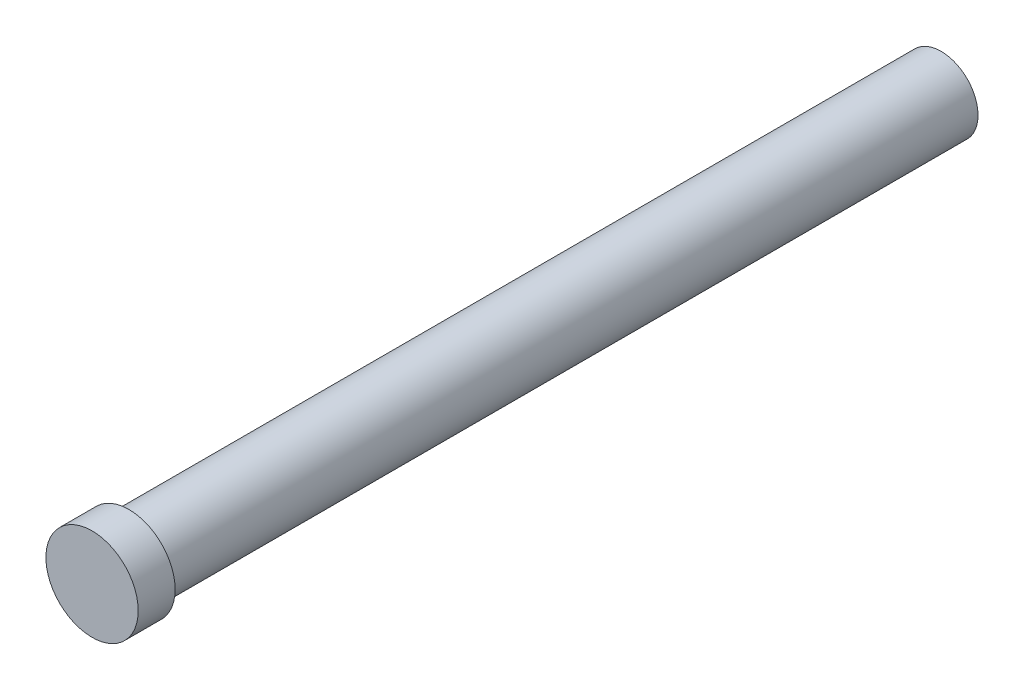
from build123d import *

# Parameters (mm, degrees)
SKETCH1_R           = 1
BOSS_EXTRUDE1_DEPTH = 22
SKETCH2_R           = 1.25
BOSS_EXTRUDE2_DEPTH = 1


with BuildPart() as part:
    # Sketch1 → Boss-Extrude1 (new body)
    with BuildSketch(Plane.XY):
        Circle(SKETCH1_R)
    extrude(amount=BOSS_EXTRUDE1_DEPTH)

    # Sketch2 → Boss-Extrude2 (add)
    with BuildSketch(Plane.XY.offset(22)):
        Circle(SKETCH2_R)
    extrude(amount=BOSS_EXTRUDE2_DEPTH)


solid = part.part
